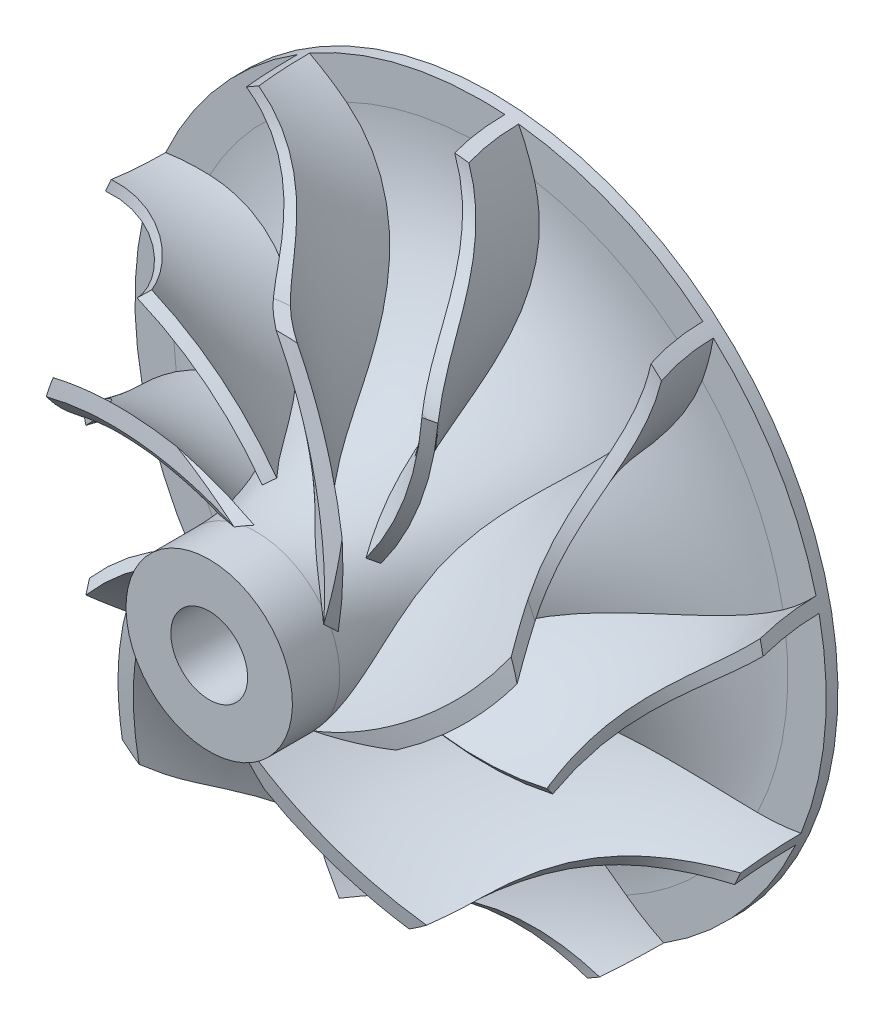
from build123d import *

# Parameters (mm, degrees)
CIRPATTERN2_COUNT  = 5
SKETCH6_R          = 2.999999999999997
CUT_EXTRUDE1_DEPTH = 57.19755034972555


with BuildPart() as part:
    # Sketch1 → Revolve1 (revolve)
    with BuildSketch(Plane(origin=(0, 0, 0), x_dir=(0, 0, -1), z_dir=(1, 0, 0))):
        with BuildLine():
            Line((-24.499999999999993, 2.999999999999994), (-24.499999999999993, 6.499999999999994))
            Line((-24.499999999999993, 6.499999999999994), (-20.799999999999997, 6.499999999999996))
            ThreePointArc((-20.799999999999997, 6.499999999999996), (-8.425631329235415, 11.625631329235416), (-3.2999999999999963, 24))
            Line((-3.2999999999999963, 24), (-3.2999999999999967, 27))
            Line((-3.2999999999999967, 27), (-2.387599999999997, 27))
            Line((-2.387599999999997, 27), (-2.3875999999999955, 16.51))
            ThreePointArc((-2.3875999999999955, 16.51), (-1.7815792808542348, 11.607430934703729), (5.18e-15, 6.999999999999999))
            Line((5.18e-15, 6.999999999999999), (6.76e-15, 2.9999999999999933))
            Line((6.76e-15, 2.9999999999999933), (-24.499999999999993, 2.999999999999994))
        make_face()
    revolve(axis=Axis((0, 0, 0), (0, -1.2e-16, 1)))

    # Sweep1: sweep along a path in Sketch3
    with BuildLine(Plane.XY) as sweep1_path:
        ThreePointArc((0, 0), (16.25, 6.736525785285309), (22.967556183773542, 22.994376767923196))
    # Sketch2 → Sweep1 (sweep)
    with BuildSketch(Plane(origin=(0, 0, 0), x_dir=(0, 0, -1), z_dir=(1, 0, 0))):
        with BuildLine():
            Line((-3.2999999999999963, 4.543800000000001), (-3.2999999999999963, 5.456200000000002))
            ThreePointArc((-3.2999999999999963, 5.456200000000002), (-13.604160769051578, 2.7197813458402536), (-21.193033846153845, -4.768390769230775))
            Line((-21.193033846153845, -4.768390769230775), (-20.40696615384615, -5.231609230769237))
            ThreePointArc((-20.40696615384615, -5.231609230769237), (-13.151483601694801, 1.9275963029658953), (-3.2999999999999963, 4.543800000000001))
        make_face()
    sweep1 = sweep(path=sweep1_path.line)

    # Sweep2: sweep along a path in Sketch5
    with BuildLine(Plane.XY) as sweep2_path:
        ThreePointArc((0, 0), (-16.249999999999996, -6.736525785285206), (-22.967556183773773, -22.994376767922954))
    # Sketch4 → Sweep2 (sweep)
    with BuildSketch(Plane(origin=(0, 0, 0), x_dir=(0, 0, -1), z_dir=(1, 0, 0))):
        with BuildLine():
            Line((-3.2999999999999976, -5.456200000000002), (-3.299999999999997, -4.543800000000001))
            ThreePointArc((-3.299999999999997, -4.543800000000001), (-10.253822824502306, -3.286343991372977), (-16.326904897344114, 0.32676016222249127))
            Line((-16.326904897344114, 0.32676016222249127), (-16.925493155395056, -0.36183685877276667))
            ThreePointArc((-16.925493155395056, -0.36183685877276667), (-10.573352039163444, -4.140963696843222), (-3.2999999999999976, -5.456200000000002))
        make_face()
    sweep2 = sweep(path=sweep2_path.line)

    # CirPattern2: Sweep1, Sweep2 ×5 about axis
    cirpattern2_axis = Axis((0, -3.04e-15, 24.499999999999993), (0, 1.2e-16, -1))
    add([sweep1.rotate(cirpattern2_axis, i * 360 / CIRPATTERN2_COUNT) for i in range(1, CIRPATTERN2_COUNT)])
    add([sweep2.rotate(cirpattern2_axis, i * 360 / CIRPATTERN2_COUNT) for i in range(1, CIRPATTERN2_COUNT)])

    # Sketch6 → Cut-Extrude1 (cut, through all)
    with BuildSketch(Plane.XY.offset(24.499999999999993)):
        Circle(SKETCH6_R)
    extrude(amount=-CUT_EXTRUDE1_DEPTH, mode=Mode.SUBTRACT)

    # Sketch7 → Cut-Revolve2 (revolve, cut)
    with BuildSketch(Plane(origin=(0, 0, 0), x_dir=(0, 0, -1), z_dir=(1, 0, 0))):
        with BuildLine():
            Line((-21.193033846153845, 6.499999999999996), (-18.98552483903627, 19.099999999999998))
            Line((-18.98552483903627, 19.099999999999998), (-16.73252483903627, 19.099999999999998))
            ThreePointArc((-16.73252483903627, 19.099999999999998), (-10.770142764730732, 21.35833848372673), (-7.799999999999996, 27.000000000000004))
            Line((-7.799999999999996, 27.000000000000004), (-3.2999999999999967, 27))
            Line((-3.2999999999999967, 27), (-3.2999999999999976, 40))
            Line((-3.2999999999999976, 40), (-21.193033846153845, 39.99999999999999))
            Line((-21.193033846153845, 39.99999999999999), (-21.193033846153845, 6.499999999999996))
        make_face()
    revolve(axis=Axis((0, 0, 0), (0, 0, 1)), mode=Mode.SUBTRACT)


solid = part.part
